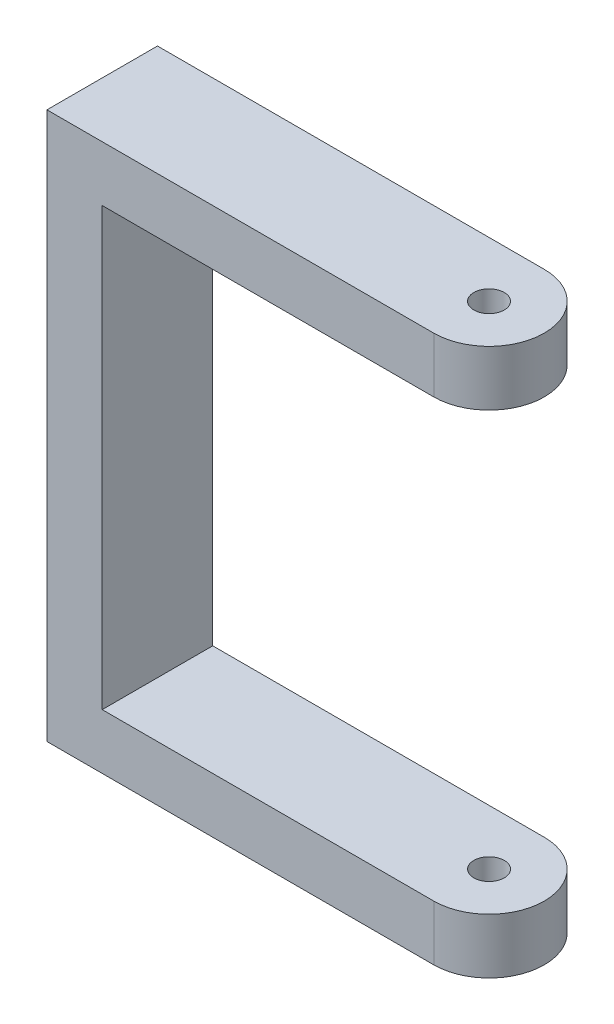
from build123d import *

# Parameters (mm, degrees)
EXTRUDE_1_DEPTH     = 20
CUT_EXTRUDE_1_DEPTH = 123.886126149


with BuildPart() as part:
    # 草图1 → 凸台-拉伸1 (new body)
    with BuildSketch(Plane.XY):
        Polygon((0, 39.5), (0, -39.5), (70, -39.5), (70, -49.5), (-10, -49.5), (-10, 49.5), (70, 49.5), (70, 39.5), align=None)
    extrude(amount=EXTRUDE_1_DEPTH)

    # 草图2 → 切除-拉伸1 (cut, through all)
    with BuildSketch(Plane(origin=(0, 49.5, 0), x_dir=(1, 0, 0), z_dir=(0, 1, 0))):
        with BuildLine():
            ThreePointArc((57.25, -10), (60, -12.75), (62.75, -10))
            Line((62.75, -10), (57.25, -10))
        make_face()
        with BuildLine():
            Line((57.25, -10), (62.75, -10))
            ThreePointArc((62.75, -10), (60, -7.25), (57.25, -10))
        make_face()
        with BuildLine():
            ThreePointArc((60, 0), (67.071067812, -2.928932188), (70, -10))
            Line((70, -10), (70, 0))
            Line((70, 0), (60, 0))
        make_face()
        with BuildLine():
            Line((70, -20), (70, -10))
            ThreePointArc((70, -10), (67.071067812, -17.071067812), (60, -20))
            Line((60, -20), (70, -20))
        make_face()
    extrude(amount=-CUT_EXTRUDE_1_DEPTH, mode=Mode.SUBTRACT)


solid = part.part
